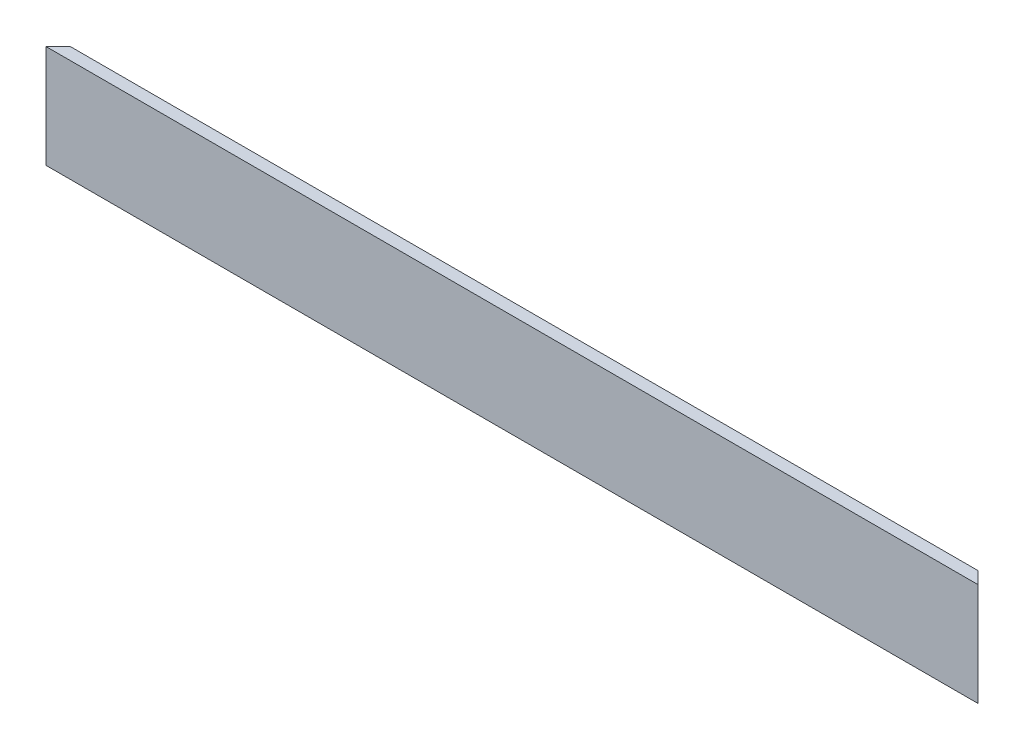
from build123d import *

# Parameters (mm, degrees)
SALIENTE_EXTRUIR1_DEPTH = 230
CORTAR_EXTRUIR1_DEPTH   = 75


with BuildPart() as part:
    # Croquis1 → Saliente-Extruir1 (new body)
    with BuildSketch(Plane(origin=(0, 0, 0), x_dir=(0, 0, -1), z_dir=(1, 0, 0))):
        Polygon((-16.874298957, 6.35), (-16.874298957, -19.05), (8.525701043, -19.05), (8.525701043, -16.05), (-13.874298957, -16.05), (-13.874298957, 6.35), align=None)
    extrude(amount=SALIENTE_EXTRUIR1_DEPTH)

    # Croquis2 → Cortar-Extruir1 (cut)
    with BuildSketch(Plane(origin=(0, 6.35, 0), x_dir=(1, 0, 0), z_dir=(0, 1, 0))):
        Polygon((0, -16.874298957), (25.4, 8.525701043), (0, 8.525701043), align=None)
        Polygon((230, -16.874298957), (204.6, 8.525701043), (230, 8.525701043), align=None)
    extrude(amount=-CORTAR_EXTRUIR1_DEPTH, mode=Mode.SUBTRACT)


solid = part.part
